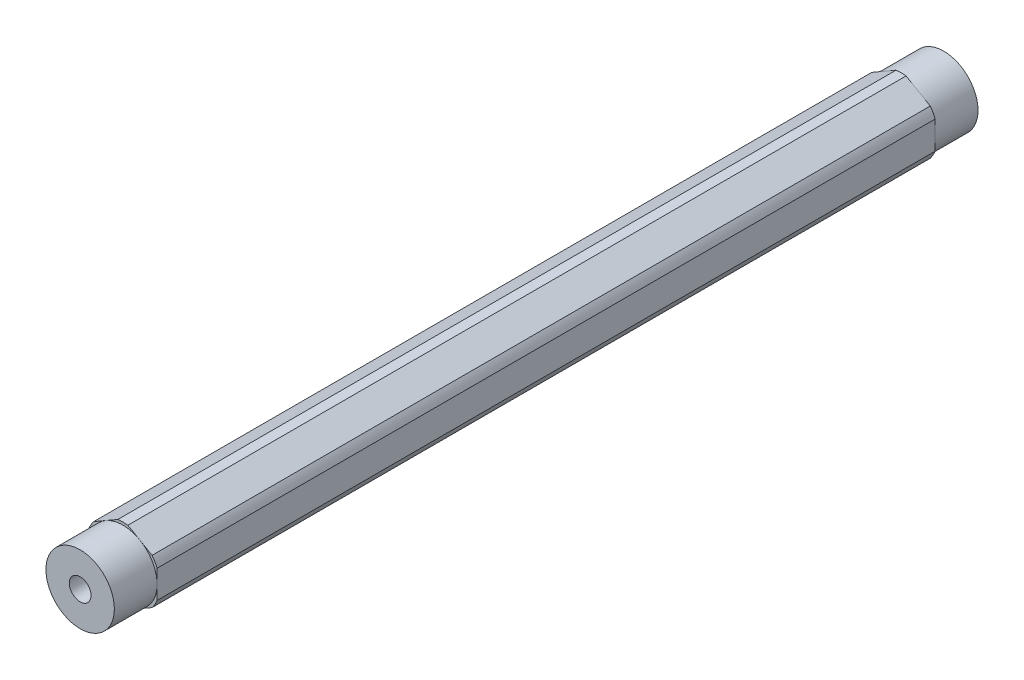
from build123d import *

# Parameters (mm, degrees)
SKETCH1_R           = 2.0193
BOSS_EXTRUDE1_DEPTH = 72.23125
SKETCH2_R           = 6.35
SKETCH2_R_2         = 2.0193
BOSS_EXTRUDE2_DEPTH = 7.9375


with BuildPart() as part:
    # Sketch1 → Boss-Extrude1 (new, symmetric)
    with BuildSketch(Plane.XY):
        with BuildLine():
            ThreePointArc((0.93173274, 6.79441227), (0, 6.858), (-0.93173274, 6.79441227))
            Line((-0.93173274, 6.79441227), (-5.41826726, 4.204110358))
            ThreePointArc((-5.41826726, 4.204110358), (-5.939202219, 3.429), (-6.35, 2.590301913))
            Line((-6.35, 2.590301913), (-6.35, -2.590301913))
            ThreePointArc((-6.35, -2.590301913), (-5.939202219, -3.429), (-5.41826726, -4.204110358))
            Line((-5.41826726, -4.204110358), (-0.93173274, -6.79441227))
            ThreePointArc((-0.93173274, -6.79441227), (0, -6.858), (0.93173274, -6.79441227))
            Line((0.93173274, -6.79441227), (5.41826726, -4.204110358))
            ThreePointArc((5.41826726, -4.204110358), (5.939202219, -3.429), (6.35, -2.590301913))
            Line((6.35, -2.590301913), (6.35, 2.590301913))
            ThreePointArc((6.35, 2.590301913), (5.939202219, 3.429), (5.41826726, 4.204110358))
            Line((5.41826726, 4.204110358), (0.93173274, 6.79441227))
        make_face()
        Circle(SKETCH1_R, mode=Mode.SUBTRACT)
    extrude(amount=BOSS_EXTRUDE1_DEPTH, both=True)

    # Sketch2 → Boss-Extrude2 (add)
    with BuildSketch(Plane.XY.offset(72.23125)):
        Circle(SKETCH2_R)
        Circle(SKETCH2_R_2, mode=Mode.SUBTRACT)
    boss_extrude2 = extrude(amount=BOSS_EXTRUDE2_DEPTH)

    # Mirror1: Boss-Extrude2 across plane
    add(boss_extrude2.mirror(Plane.XY))


solid = part.part
